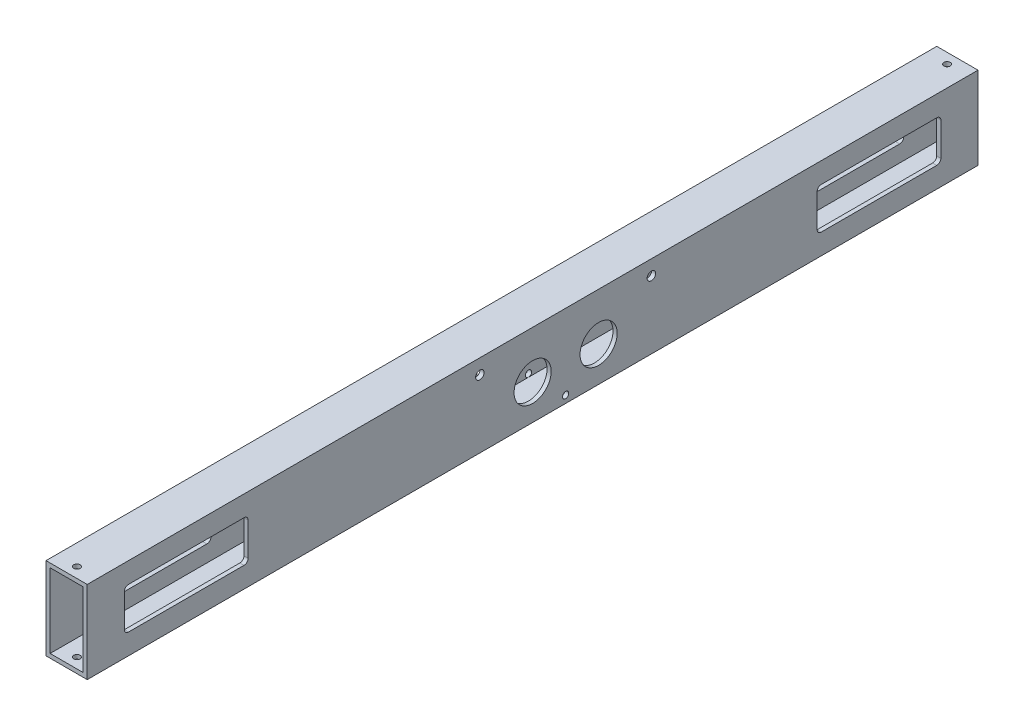
from build123d import *

# Parameters (mm, degrees)
SKETCH1_W                    = 31.75
SKETCH1_H                    = 63.5
SKETCH1_W_2                  = 25.4
SKETCH1_H_2                  = 57.15
BOSS_EXTRUDE1_DEPTH          = 685.8
CUT_EXTRUDE1_REACH           = 691.238
F_10_0_1935_DIAMETER_HOLE1_D = 4.9149
CUT_EXTRUDE2_START           = -31.75
SKETCH6_R                    = 14.2875
SKETCH6_R_2                  = 3.2639
SKETCH6_R_3                  = 2.413
CUT_EXTRUDE2_DEPTH           = 31.75


with BuildPart() as part:
    # Sketch1 → Boss-Extrude1 (new body)
    with BuildSketch(Plane.XY):
        with Locations((3.710272719, -29.23968021)):
            Rectangle(SKETCH1_W, SKETCH1_H)
        with Locations((3.710272719, -29.23968021)):
            Rectangle(SKETCH1_W_2, SKETCH1_H_2, mode=Mode.SUBTRACT)
    extrude(amount=BOSS_EXTRUDE1_DEPTH)

    # Cut-Extrude1: up to this face of the body (flat: up to its plane)
    cut_extrude1_end = Plane(part.part.faces().sort_by_distance((19.585272719, -29.23968021, 342.9))[0])
    # Sketch3 → Cut-Extrude1 (cut, up to the picked face)
    with BuildSketch(Plane.ZY.offset(12.164727281), mode=Mode.PRIVATE) as cut_extrude1_sk1:
        with BuildLine():
            Line((31.7754, -13.36468021), (120.6754, -13.36468021))
            ThreePointArc((120.6754, -13.36468021), (122.92046403, -14.294616179), (123.8504, -16.53968021))
            Line((123.8504, -16.53968021), (123.8504, -41.93968021))
            ThreePointArc((123.8504, -41.93968021), (122.92046403, -44.18474424), (120.6754, -45.11468021))
            Line((120.6754, -45.11468021), (31.7754, -45.11468021))
            ThreePointArc((31.7754, -45.11468021), (29.53033597, -44.18474424), (28.6004, -41.93968021))
            Line((28.6004, -41.93968021), (28.6004, -16.53968021))
            ThreePointArc((28.6004, -16.53968021), (29.53033597, -14.294616179), (31.7754, -13.36468021))
        make_face()
    cut_extrude1_tool1 = split(extrude(cut_extrude1_sk1.sketch, amount=-CUT_EXTRUDE1_REACH, mode=Mode.PRIVATE), bisect_by=cut_extrude1_end, keep=Keep.BOTH, mode=Mode.PRIVATE)
    # Sketch3 → Cut-Extrude1 (cut, up to the picked face)
    with BuildSketch(Plane.ZY.offset(12.164727281), mode=Mode.PRIVATE) as cut_extrude1_sk2:
        with BuildLine():
            ThreePointArc((657.1996, -41.93968021), (656.26966403, -44.18474424), (654.0246, -45.11468021))
            Line((654.0246, -45.11468021), (565.1246, -45.11468021))
            ThreePointArc((565.1246, -45.11468021), (562.87953597, -44.18474424), (561.9496, -41.93968021))
            Line((561.9496, -41.93968021), (561.9496, -16.53968021))
            ThreePointArc((561.9496, -16.53968021), (562.87953597, -14.294616179), (565.1246, -13.36468021))
            Line((565.1246, -13.36468021), (654.0246, -13.36468021))
            ThreePointArc((654.0246, -13.36468021), (656.26966403, -14.294616179), (657.1996, -16.53968021))
            Line((657.1996, -16.53968021), (657.1996, -41.93968021))
        make_face()
    cut_extrude1_tool2 = split(extrude(cut_extrude1_sk2.sketch, amount=-CUT_EXTRUDE1_REACH, mode=Mode.PRIVATE), bisect_by=cut_extrude1_end, keep=Keep.BOTH, mode=Mode.PRIVATE)
    add(cut_extrude1_tool1.solids().sort_by(Axis((-12.164727, -29.23968, 76.2254), (1, 0, 0)))[0], mode=Mode.SUBTRACT)
    add(cut_extrude1_tool2.solids().sort_by(Axis((-12.164727, -29.23968, 609.5746), (1, 0, 0)))[0], mode=Mode.SUBTRACT)

    # #10 (0.1935) Diameter Hole1 (through all)
    with Locations(Plane(origin=(3.710272719, 2.51031979, 677.8625), x_dir=(1, 0, 0), z_dir=(0, 1, 0))):
        with Locations((0, 0), (0, 669.925)):
            Hole(F_10_0_1935_DIAMETER_HOLE1_D / 2)

    # Sketch6 → Cut-Extrude2 (cut)
    with BuildSketch(Plane(origin=(19.585272719, 0, 0), x_dir=(0, 0, -1), z_dir=(1, 0, 0)).offset(CUT_EXTRUDE2_START)):
        with Locations(Location((-342.9, -34.00218021, 0), (0, 0, 90))):
            Circle(SKETCH6_R)
        with Locations(Location((-383.54, -8.91968021, 0), (0, 0, 90))):
            Circle(SKETCH6_R_2)
        with Locations(Location((-251.46, -8.91968021, 0), (0, 0, 90))):
            Circle(SKETCH6_R_2)
        with Locations(Location((-317.5, -55.40168021, 0), (0, 0, 90))):
            Circle(SKETCH6_R_3)
        with Locations(Location((-292.1, -34.00218021, 0), (0, 0, 90))):
            Circle(SKETCH6_R)
    extrude(amount=CUT_EXTRUDE2_DEPTH, mode=Mode.SUBTRACT)


solid = part.part
